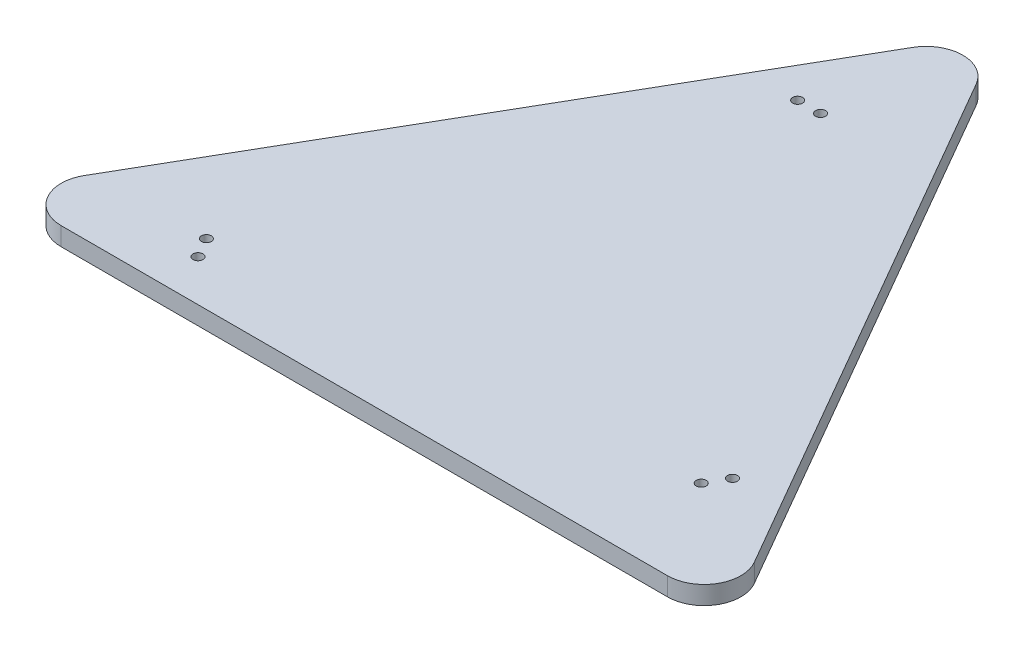
from build123d import *

# Parameters (mm, degrees)
BOSS_EXTRUDE1_DEPTH = 6.35
SKETCH2_R           = 1.7272
CUT_EXTRUDE1_DEPTH  = 195.099602868
FILLET1_R           = 12.7


with BuildPart() as part:
    # Sketch1 → Boss-Extrude1 (new body)
    with BuildSketch(Plane(origin=(0, 0, 0), x_dir=(1, 0, 0), z_dir=(0, 1, 0))):
        Polygon((0, 146.646968374), (-127, -73.323484187), (127, -73.323484187), align=None)
    extrude(amount=BOSS_EXTRUDE1_DEPTH)

    # Sketch2 → Cut-Extrude1 (cut, through all)
    with BuildSketch(Plane(origin=(0, 6.35, 0), x_dir=(1, 0, 0), z_dir=(0, 1, 0))):
        with Locations((83.080121807, -39.724771067)):
            Circle(SKETCH2_R)
        with Locations((87.042521807, -32.861692947)):
            Circle(SKETCH2_R)
        with Locations((-75.942721807, -52.087110501)):
            Circle(SKETCH2_R)
        with Locations((-71.980321807, -58.950188621)):
            Circle(SKETCH2_R)
        with Locations((-7.1374, 91.811881567)):
            Circle(SKETCH2_R)
        with Locations((-15.0622, 91.811881567)):
            Circle(SKETCH2_R)
    extrude(amount=-CUT_EXTRUDE1_DEPTH, mode=Mode.SUBTRACT)

    # Fillet1
    fillet1_edges = [part.edges().sort_by_distance(p)[0] for p in [
        (127, 3.175, 73.323484187),
        (-127, 3.175, 73.323484187),
        (0, 3.175, -146.646968374),
    ]]
    fillet(fillet1_edges, radius=FILLET1_R)


solid = part.part
